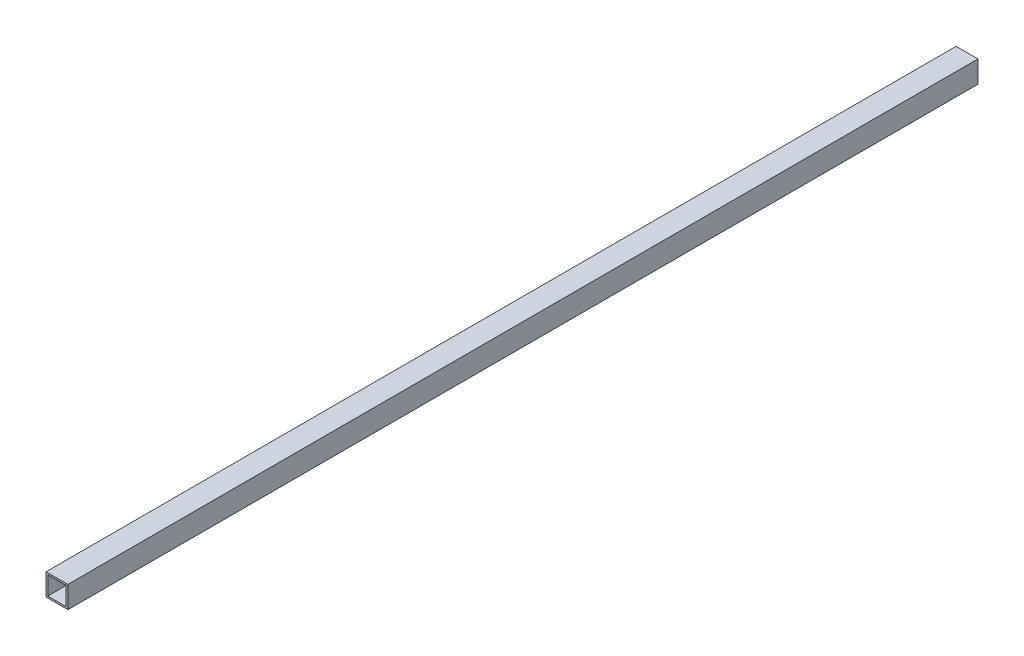
from build123d import *

# Parameters (mm, degrees)
SKETCH1_W           = 25
SKETCH1_H           = 25
SKETCH1_W_2         = 21
SKETCH1_H_2         = 21
BOSS_EXTRUDE1_DEPTH = 520


with BuildPart() as part:
    # Sketch1 → Boss-Extrude1 (new, symmetric)
    with BuildSketch(Plane.XY):
        Rectangle(SKETCH1_W, SKETCH1_H)
        Rectangle(SKETCH1_W_2, SKETCH1_H_2, mode=Mode.SUBTRACT)
    extrude(amount=BOSS_EXTRUDE1_DEPTH, both=True)


solid = part.part
